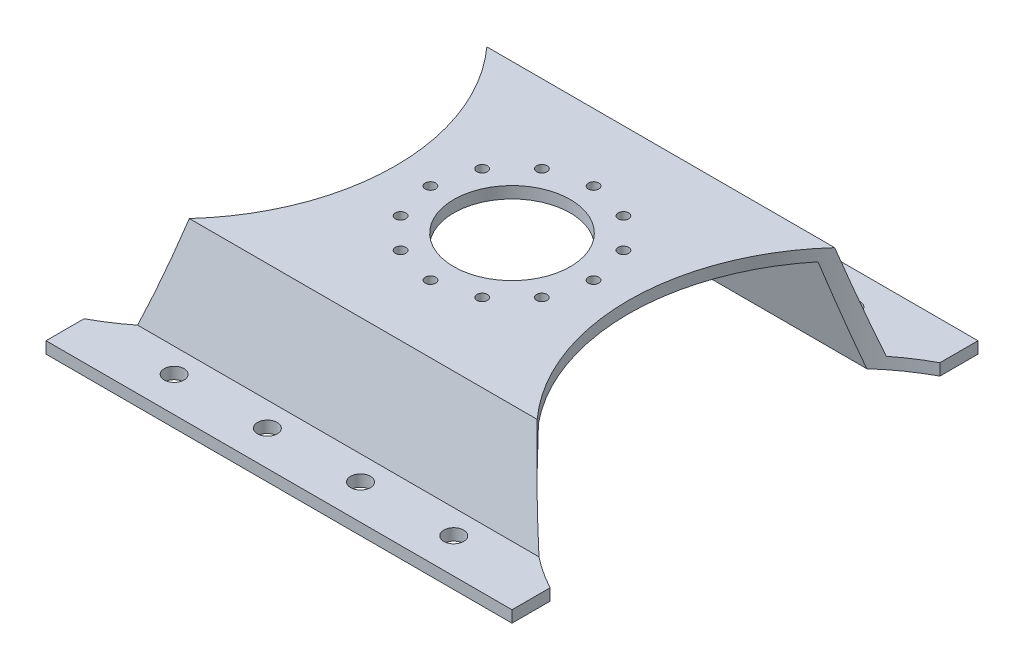
from build123d import *

# Parameters (mm, degrees)
EXTRUDE_1_DEPTH     = 200
SKETCH_2_R          = 95
CUT_EXTRUDE_1_DEPTH = 150
SKETCH_3_R          = 4.25
CUT_EXTRUDE_2_DEPTH = 150
SKETCH_4_R          = 2.25
SKETCH_4_R_2        = 25
CUT_EXTRUDE_3_DEPTH = 10


with BuildPart() as part:
    # 草图1 → 凸台-拉伸1 (new body)
    with BuildSketch(Plane(origin=(0, 0, 0), x_dir=(0, 0, -1), z_dir=(1, 0, 0))):
        Polygon((-100, 0), (-70.717967697, 0), (-60, 40), (60, 40), (70.717967697, 0), (100, 0), (100, 5), (74.554602637, 5), (63.83663494, 45), (-63.83663494, 45), (-74.554602637, 5), (-100, 5), align=None)
    extrude(amount=EXTRUDE_1_DEPTH)

    # 草图2 → 切除-拉伸1 (cut)
    with BuildSketch(Plane(origin=(0, 45, 0), x_dir=(1, 0, 0), z_dir=(0, 1, 0))):
        with Locations((245, 0)):
            Circle(SKETCH_2_R)
        with Locations((-45, 0)):
            Circle(SKETCH_2_R)
    extrude(amount=-CUT_EXTRUDE_1_DEPTH, mode=Mode.SUBTRACT)

    # 草图3 → 切除-拉伸2 (cut)
    with BuildSketch(Plane(origin=(0, 5, 0), x_dir=(1, 0, 0), z_dir=(0, 1, 0))):
        with Locations(Location((120, -85, 0), (0, 0, 270))):
            Circle(SKETCH_3_R)
        with Locations(Location((160, -85, 0), (0, 0, 270))):
            Circle(SKETCH_3_R)
        with Locations(Location((40, -85, 0), (0, 0, 270))):
            Circle(SKETCH_3_R)
        with Locations(Location((80, -85, 0), (0, 0, 270))):
            Circle(SKETCH_3_R)
        with Locations(Location((160, 85, 0), (0, 0, 270))):
            Circle(SKETCH_3_R)
        with Locations(Location((120, 85, 0), (0, 0, 270))):
            Circle(SKETCH_3_R)
        with Locations(Location((80, 85, 0), (0, 0, 270))):
            Circle(SKETCH_3_R)
        with Locations(Location((40, 85, 0), (0, 0, 270))):
            Circle(SKETCH_3_R)
    extrude(amount=-CUT_EXTRUDE_2_DEPTH, mode=Mode.SUBTRACT)

    # 草图4 → 切除-拉伸3 (cut)
    with BuildSketch(Plane(origin=(0, 45, 0), x_dir=(1, 0, 0), z_dir=(0, 1, 0))):
        with Locations(Location((100, 35, 0), (0, 0, 270))):
            Circle(SKETCH_4_R)
        with Locations(Location((117.5, 30.310889132, 0), (0, 0, 270))):
            Circle(SKETCH_4_R)
        with Locations(Location((130.310889132, 17.5, 0), (0, 0, 270))):
            Circle(SKETCH_4_R)
        with Locations(Location((135, 0, 0), (0, 0, 270))):
            Circle(SKETCH_4_R)
        with Locations(Location((130.310889132, -17.5, 0), (0, 0, 270))):
            Circle(SKETCH_4_R)
        with Locations(Location((117.5, -30.310889132, 0), (0, 0, 270))):
            Circle(SKETCH_4_R)
        with Locations(Location((100, -35, 0), (0, 0, 270))):
            Circle(SKETCH_4_R)
        with Locations(Location((82.5, -30.310889132, 0), (0, 0, 270))):
            Circle(SKETCH_4_R)
        with Locations(Location((69.689110868, -17.5, 0), (0, 0, 270))):
            Circle(SKETCH_4_R)
        with Locations(Location((65, 0, 0), (0, 0, 270))):
            Circle(SKETCH_4_R)
        with Locations(Location((69.689110868, 17.5, 0), (0, 0, 270))):
            Circle(SKETCH_4_R)
        with Locations(Location((82.5, 30.310889132, 0), (0, 0, 270))):
            Circle(SKETCH_4_R)
        with Locations(Location((100, 0, 0), (0, 0, 270))):
            Circle(SKETCH_4_R_2)
    extrude(amount=-CUT_EXTRUDE_3_DEPTH, mode=Mode.SUBTRACT)


solid = part.part
